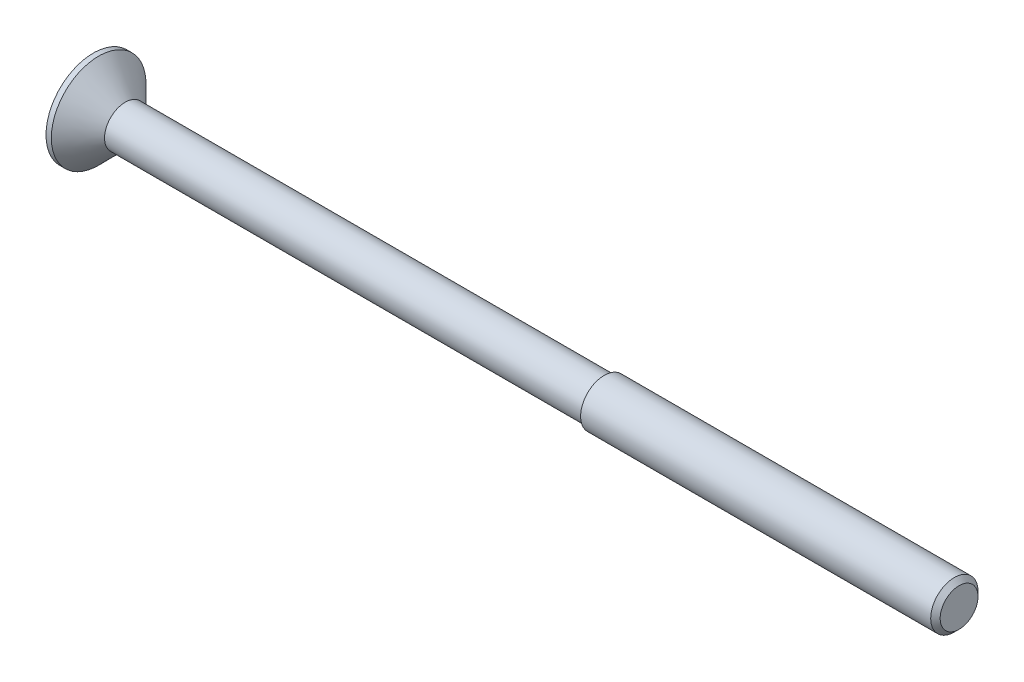
from build123d import *

# Parameters (mm, degrees)
ENL_V_MAT_EXTRU_1_DEPTH      = 0.7
R_P_TITION_CIRCULAIRE1_COUNT = 4
ENL_V_MAT_EXTRU_2_REACH      = 75.418
ESQUISSE3_R                  = 1.25


with BuildPart() as part:
    # Esquisse1 → Révolution1 (revolve)
    with BuildSketch(Plane.XY, mode=Mode.PRIVATE) as r_volution1_sk:
        Polygon((0, 0), (0, 4), (0.45, 4), (2.7, 1.75), (43.2, 1.75), (43.2, 2), (72.8, 2), (73.2, 1.6), (73.2, 0), align=None)
    revolve(r_volution1_sk.sketch.rotate(Axis((0, 0, 0), (1, 0, 0)), 90), axis=Axis((0, 0, 0), (1, 0, 0)))

    # Esquisse2 → Enlèv. mat.-Extru.1 (cut, symmetric)
    with BuildSketch(Plane.XY):
        Polygon((0, 0), (0, 2.5), (0.5, 2), (2.5, 1.002836784), (2.5, 0), align=None)
    enl_v_mat_extru_1 = extrude(amount=ENL_V_MAT_EXTRU_1_DEPTH, both=True, mode=Mode.SUBTRACT)

    # Répétition circulaire1: Enlèv. mat.-Extru.1 ×4 about axis
    r_p_tition_circulaire1_axis = Axis((0, 0, 0), (1, 0, 0))
    for i in range(1, R_P_TITION_CIRCULAIRE1_COUNT):
        add(enl_v_mat_extru_1.rotate(r_p_tition_circulaire1_axis, i * 360 / R_P_TITION_CIRCULAIRE1_COUNT), mode=Mode.SUBTRACT)

    # Enlèv. mat.-Extru.2: up to this face of the body (flat: up to its plane)
    enl_v_mat_extru_2_end = Plane(part.part.faces().sort_by_distance((2.5, 0, 0))[0])
    # Esquisse3 → Enlèv. mat.-Extru.2 (cut, up to the picked face)
    with BuildSketch(Plane.ZY, mode=Mode.PRIVATE) as enl_v_mat_extru_2_sk1:
        with Locations(Location((0, 0, 0), (0, 0, 325.944202257))):
            Circle(ESQUISSE3_R)
    enl_v_mat_extru_2_tool1 = split(extrude(enl_v_mat_extru_2_sk1.sketch, amount=-ENL_V_MAT_EXTRU_2_REACH, mode=Mode.PRIVATE), bisect_by=enl_v_mat_extru_2_end, keep=Keep.BOTH, mode=Mode.PRIVATE)
    add(enl_v_mat_extru_2_tool1.solids().sort_by(Axis((0, 0, 0), (1, 0, 0)))[0], mode=Mode.SUBTRACT)


solid = part.part
